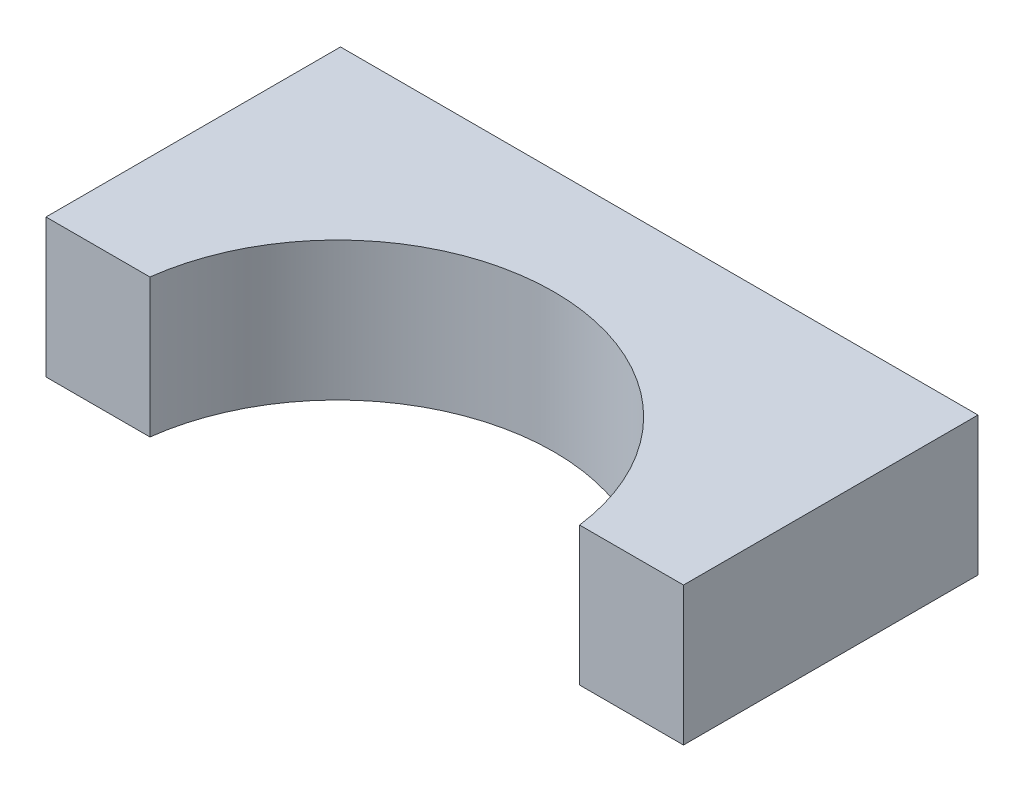
from build123d import *

# Parameters (mm, degrees)
BOSS_EXTRUDE1_DEPTH = 10.16
CUT_EXTRUDE1_DEPTH  = 4.064


with BuildPart() as part:
    # Sketch2 → Boss-Extrude1 (new body)
    with BuildSketch(Plane(origin=(0, 0, 0), x_dir=(1, 0, 0), z_dir=(0, 1, 0))):
        with BuildLine():
            Line((-14.986, -8.89), (-7.366, -8.89))
            ThreePointArc((-7.366, -8.89), (8.382, 4.980973803), (24.13, -8.89))
            Line((24.13, -8.89), (31.75, -8.89))
            Line((31.75, -8.89), (31.75, 12.7))
            Line((31.75, 12.7), (-14.986, 12.7))
            Line((-14.986, 12.7), (-14.986, -8.89))
        make_face()
    extrude(amount=-BOSS_EXTRUDE1_DEPTH)

    # Sketch6 → Cut-Extrude1 (cut)
    with BuildSketch(Plane(origin=(0, 0, -12.7), x_dir=(-1, 0, 0), z_dir=(0, 0, -1))):
        with BuildLine():
            ThreePointArc((-28.9433, -5.08), (-27.94, -6.0833), (-26.9367, -5.08))
            Line((-26.9367, -5.08), (-27.94, -5.08))
            Line((-27.94, -5.08), (-28.9433, -5.08))
        make_face()
        with BuildLine():
            Line((-27.94, -5.08), (-26.9367, -5.08))
            ThreePointArc((-26.9367, -5.08), (-27.94, -4.0767), (-28.9433, -5.08))
            Line((-28.9433, -5.08), (-27.94, -5.08))
        make_face()
        with BuildLine():
            Line((10.1727, -5.08), (11.176, -5.08))
            Line((11.176, -5.08), (12.1793, -5.08))
            ThreePointArc((12.1793, -5.08), (11.176, -4.0767), (10.1727, -5.08))
        make_face()
        with BuildLine():
            Line((12.1793, -5.08), (11.176, -5.08))
            Line((11.176, -5.08), (10.1727, -5.08))
            ThreePointArc((10.1727, -5.08), (11.176, -6.0833), (12.1793, -5.08))
        make_face()
    extrude(amount=-CUT_EXTRUDE1_DEPTH, mode=Mode.SUBTRACT)


solid = part.part
